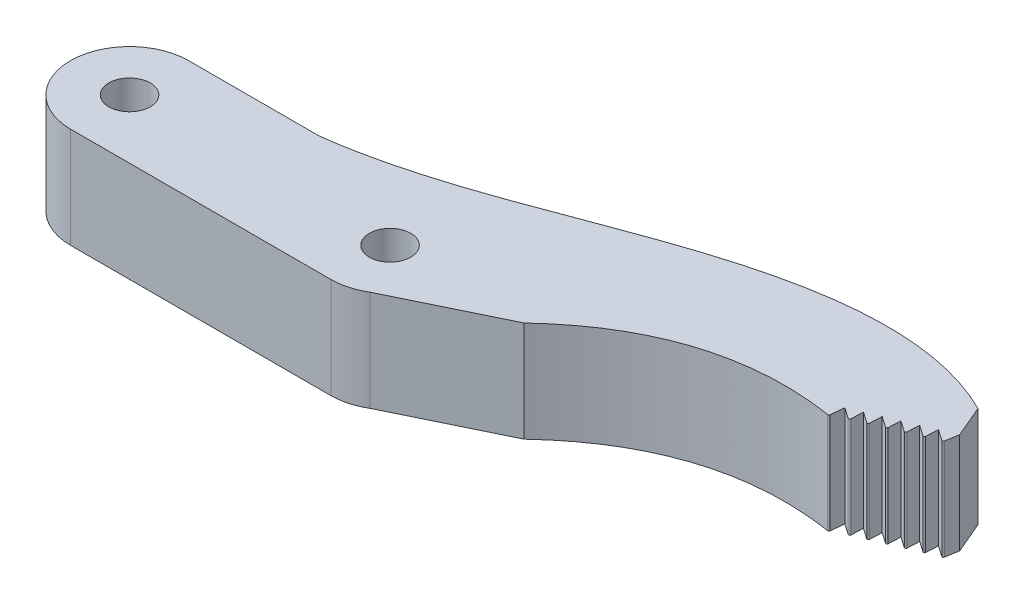
from build123d import *

# Parameters (mm, degrees)
SKETCH1_R           = 1.75
BOSS_EXTRUDE1_DEPTH = 8.5
BOSS_EXTRUDE2_DEPTH = 8.5
CUT_EXTRUDE1_DEPTH  = 8.5
FILLET1_R           = 0.1


with BuildPart() as part:
    # Sketch1 → Boss-Extrude1 (new body)
    with BuildSketch(Plane(origin=(0, 0, 0), x_dir=(1, 0, 0), z_dir=(0, 1, 0))):
        with BuildLine():
            Line((0, 5), (22, 5))
            ThreePointArc((22, 5), (27, 0), (22, -5))
            Line((22, -5), (0, -5))
            ThreePointArc((0, -5), (-5, 0), (0, 5))
        make_face()
        with Locations(Location((0, 0, 0), (0, 0, 270))):
            Circle(SKETCH1_R, mode=Mode.SUBTRACT)
        with Locations(Location((22, 0, 0), (0, 0, 270))):
            Circle(SKETCH1_R, mode=Mode.SUBTRACT)
    extrude(amount=BOSS_EXTRUDE1_DEPTH)

    # Sketch2 → Boss-Extrude2 (add)
    with BuildSketch(Plane(origin=(0, 8.5, 0), x_dir=(1, 0, 0), z_dir=(0, 1, 0))):
        with BuildLine():
            Line((24.179012082, -4.476059884), (33.341557569, -0.026966843))
            add(Edge.make_bspline(
                [(33.341557569, -0.026966843), (41.749820473, 7.89313442), (52.969012082, 6.083442161)],
                knots=[0, 0, 0, 1, 1, 1], degree=2))
            Line((52.969012082, 6.083442161), (60.334686591, 9.205434959))
            Line((60.334686591, 9.205434959), (58.773690192, 12.888272213))
            add(Edge.make_bspline(
                [(58.773690192, 12.888272213), (52.774224243, 15.890799399), (35.603615653, 14.597846237), (21.152761079, 6.296000311), (11, 5)],
                knots=[0, 0, 0, 0, 0.392136184, 1, 1, 1, 1], degree=3))
            Line((11, 5), (22, 5))
            ThreePointArc((22, 5), (26.8616817, 1.129378711), (24.179012082, -4.476059884))
        make_face()
    extrude(amount=-BOSS_EXTRUDE2_DEPTH)

    # Sketch3 → Cut-Extrude1 (cut)
    with BuildSketch(Plane(origin=(0, 8.5, 0), x_dir=(1, 0, 0), z_dir=(0, 1, 0))):
        Polygon((53.093613314, 7.319249743), (52.969012082, 6.083442161), (54.158655304, 6.587680784), align=None)
        Polygon((54.199304069, 7.787904524), (54.158655304, 6.587680784), (55.255605115, 7.052630654), align=None)
        Polygon((55.31150405, 8.259318286), (55.255605115, 7.052630654), (56.367805096, 7.524044416), align=None)
        Polygon((56.423704031, 8.730732048), (56.367805096, 7.524044416), (57.480005077, 7.995458178), align=None)
        Polygon((57.535904012, 9.202145811), (57.480005077, 7.995458178), (58.592205058, 8.46687194), align=None)
        Polygon((58.648103993, 9.673559573), (58.592205058, 8.46687194), (59.704405039, 8.938285702), align=None)
        Polygon((59.909629601, 10.208266049), (59.704405039, 8.938285702), (60.334686591, 9.205434959), align=None)
    extrude(amount=-CUT_EXTRUDE1_DEPTH, mode=Mode.SUBTRACT)

    # Fillet1
    fillet1_edges = [part.edges().sort_by_distance(p)[0] for p in [
        (57.480005077, 4.25, -7.995458178),
        (59.704405039, 4.25, -8.938285702),
        (52.969012082, 4.25, -6.083442161),
        (54.158655304, 4.25, -6.587680784),
        (56.367805096, 4.25, -7.524044416),
        (58.592205058, 4.25, -8.46687194),
        (55.255605115, 4.25, -7.052630654),
    ]]
    fillet(fillet1_edges, radius=FILLET1_R)


solid = part.part
